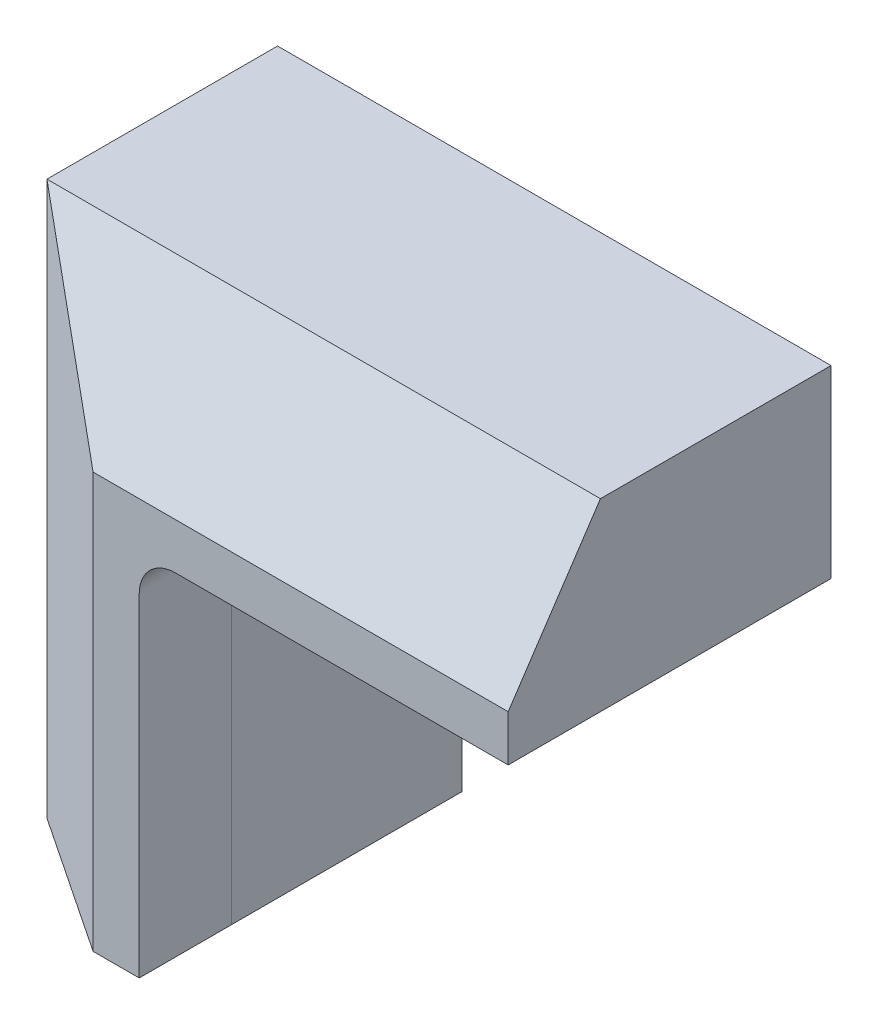
from build123d import *

# Parameters (mm, degrees)
BOSS_EXTRUDE1_DEPTH = 12.7
CUT_EXTRUDE1_DEPTH  = 2.54


with BuildPart() as part:
    # Sketch1 → Boss-Extrude1 (new body)
    with BuildSketch(Plane.XY):
        with BuildLine():
            Line((0, -1.99898), (0, -20.32))
            Line((0, -20.32), (-10.16, -20.32))
            Line((-10.16, -20.32), (-10.16, 0))
            Line((-10.16, 0), (-10.16, 6.1595))
            Line((-10.16, 6.1595), (-10.16, 10.16))
            Line((-10.16, 10.16), (-6.1595, 10.16))
            Line((-6.1595, 10.16), (20.32, 10.16))
            Line((20.32, 10.16), (20.32, 0))
            Line((20.32, 0), (1.99898, 0))
            ThreePointArc((1.99898, 0), (0.585487687, -0.585487687), (0, -1.99898))
        make_face()
    extrude(amount=BOSS_EXTRUDE1_DEPTH)

    # Sketch4 → Cut-Extrude1 (cut)
    # profile 1 of 5: a face of its own
    with BuildSketch(Plane.XY):
        with BuildLine():
            Line((5.478910256, 5.715), (4.842892628, 5.715))
            add(Edge.make_bspline(
                [(4.842892628, 5.715), (4.801336061, 5.714813984), (4.721164733, 5.71445512), (4.605551082, 5.710103418), (4.498891829, 5.702304902), (4.401211477, 5.692667169), (4.312550191, 5.679155443), (4.23279694, 5.663665308), (4.161935174, 5.644793814), (4.09916582, 5.622393613), (4.042832353, 5.59598465), (3.989522723, 5.56785722), (3.940441735, 5.534288125), (3.893112123, 5.498895298), (3.850239803, 5.458297677), (3.809150141, 5.415197093), (3.771583399, 5.367884211), (3.737365504, 5.316931741), (3.706324601, 5.263281068), (3.679205192, 5.206836279), (3.657207445, 5.147508057), (3.638754072, 5.085680187), (3.623932142, 5.021355365), (3.614066194, 4.954137987), (3.607364746, 4.88449739), (3.606773435, 4.837099955), (3.606474359, 4.813127003)],
                knots=[0, 0, 0, 0, 1.698747864, 3.27724071, 4.728299578, 6.070144658, 7.288476769, 8.393259625, 9.389771311, 10.283485332, 11.113357557, 11.931608583, 12.74405601, 13.541433047, 14.344816069, 15.154114104, 15.974336324, 16.810834471, 17.661136416, 18.50621059, 19.367396281, 20.244825668, 21.142564693, 22.063065223, 23.020325768, 24, 24, 24, 24], degree=3))
            add(Edge.make_bspline(
                [(3.606474359, 4.813127003), (3.606907085, 4.786606297), (3.607757445, 4.73448985), (3.616093713, 4.658093533), (3.630334691, 4.585256561), (3.648946906, 4.515364688), (3.674900315, 4.449567789), (3.704550867, 4.386295931), (3.74103045, 4.327323062), (3.782714206, 4.271911502), (3.828237623, 4.21961073), (3.878681424, 4.171930831), (3.93308413, 4.128546773), (3.991130823, 4.089003888), (4.053039427, 4.053381942), (4.118765272, 4.021347374), (4.188757172, 3.993924749), (4.237497425, 3.979582938), (4.262208534, 3.972311699)],
                knots=[0, 0, 0, 0, 1.102006807, 2.165578795, 3.188629044, 4.184801286, 5.166646146, 6.124351954, 7.085497154, 8.042432466, 9.003981491, 9.963833307, 10.922997304, 11.89326795, 12.880200226, 13.889073926, 14.929769137, 16, 16, 16, 16], degree=3))
            add(Edge.make_bspline(
                [(4.262208534, 3.972311699), (4.278484691, 3.968262164), (4.31374409, 3.959489569), (4.37208871, 3.950583183), (4.439324758, 3.942394308), (4.515669654, 3.935356962), (4.60116741, 3.930573206), (4.695735244, 3.926837306), (4.799416012, 3.924120921), (4.871511518, 3.924024531), (4.909038462, 3.923974359)],
                knots=[0, 0, 0, 0, 0.618981996, 1.340914327, 2.176866532, 3.120127938, 4.170906482, 5.338178032, 6.614476169, 8, 8, 8, 8], degree=3))
            Line((4.909038462, 3.923974359), (4.909038462, 2.54))
            Line((4.909038462, 2.54), (5.478910256, 2.54))
            Line((5.478910256, 2.54), (5.478910256, 5.715))
        make_face()
        with BuildLine():
            Line((4.909038462, 4.493846154), (4.707420873, 4.493846154))
            add(Edge.make_bspline(
                [(4.707420873, 4.493846154), (4.67073337, 4.494078781), (4.603227819, 4.494506819), (4.511039075, 4.500696491), (4.436954427, 4.510149371), (4.378426179, 4.523706987), (4.332212584, 4.544282464), (4.292356251, 4.568084417), (4.258170457, 4.598181333), (4.228570591, 4.632572209), (4.20490639, 4.672089049), (4.1884965, 4.716088399), (4.177836957, 4.763645784), (4.176852449, 4.796742577), (4.176346154, 4.813763021)],
                knots=[0, 0, 0, 0, 1.8619151, 3.425951444, 4.686033666, 5.651700536, 6.461346321, 7.243864085, 7.999046032, 8.762387399, 9.539336099, 10.322741239, 11.137448474, 12, 12, 12, 12], degree=3))
            add(Edge.make_bspline(
                [(4.176346154, 4.813763021), (4.176847241, 4.828633561), (4.177819472, 4.857485985), (4.184961741, 4.899127188), (4.196344465, 4.93794538), (4.212837593, 4.973535156), (4.234159303, 5.005836043), (4.260154781, 5.034835316), (4.290490456, 5.06115402), (4.313911371, 5.075084912), (4.325810296, 5.08216246)],
                knots=[0, 0, 0, 0, 1.102301479, 2.1387299, 3.123554645, 4.094223062, 5.036071848, 5.982632524, 6.975082478, 8, 8, 8, 8], degree=3))
            add(Edge.make_bspline(
                [(4.325810296, 5.08216246), (4.335889373, 5.087259738), (4.357228845, 5.098051721), (4.393572033, 5.11059819), (4.435511518, 5.121182518), (4.483330437, 5.129967409), (4.536838028, 5.136785396), (4.596024744, 5.141999451), (4.660977683, 5.144096225), (4.706148566, 5.144774724), (4.72968149, 5.145128205)],
                knots=[0, 0, 0, 0, 0.656809284, 1.390599849, 2.23162475, 3.173112763, 4.218524733, 5.370385145, 6.63003504, 8, 8, 8, 8], degree=3))
            Line((4.72968149, 5.145128205), (4.909038462, 5.145128205))
            Line((4.909038462, 5.145128205), (4.909038462, 4.493846154))
        make_face(mode=Mode.SUBTRACT)
    # profile 2 of 5: a face of its own
    with BuildSketch(Plane.XY):
        with BuildLine():
            Line((8.043333333, 5.715), (7.379330929, 5.715))
            add(Edge.make_bspline(
                [(7.379330929, 5.715), (7.335440573, 5.714844214), (7.251027053, 5.714544595), (7.129307369, 5.709817392), (7.0174911, 5.703239101), (6.915412692, 5.693200455), (6.823115815, 5.679890424), (6.740507968, 5.664200099), (6.667591563, 5.64631761), (6.603751653, 5.624034619), (6.546139291, 5.598899742), (6.49243656, 5.570019307), (6.441458697, 5.537714908), (6.393546436, 5.501136528), (6.348283406, 5.460942202), (6.305584217, 5.417091473), (6.266052248, 5.369212502), (6.229932282, 5.317607826), (6.197011841, 5.26332089), (6.167917075, 5.206277157), (6.144257163, 5.146436959), (6.123351095, 5.084665114), (6.108293131, 5.020078583), (6.097820538, 4.953306125), (6.090152914, 4.884112696), (6.089712063, 4.837105753), (6.089487179, 4.813127003)],
                knots=[0, 0, 0, 0, 1.749336639, 3.364467119, 4.854658419, 6.213483162, 7.451590619, 8.570285859, 9.5643256, 10.440900261, 11.26203566, 12.067320669, 12.869050712, 13.665104639, 14.467235401, 15.27997916, 16.102287765, 16.939272006, 17.78853747, 18.631303466, 19.488103222, 20.351255419, 21.228522269, 22.127379805, 23.044756219, 24, 24, 24, 24], degree=3))
            add(Edge.make_bspline(
                [(6.089487179, 4.813127003), (6.090071345, 4.788098697), (6.091216788, 4.739022751), (6.097386764, 4.666934188), (6.108663542, 4.597964894), (6.125743863, 4.532316801), (6.145375474, 4.469172843), (6.17148048, 4.409698066), (6.20094256, 4.353027495), (6.235933812, 4.299962756), (6.274335001, 4.249325176), (6.318994776, 4.203054868), (6.36701987, 4.158664978), (6.421109948, 4.118935939), (6.478880669, 4.081181417), (6.541479876, 4.046965765), (6.608499026, 4.015428881), (6.655616808, 3.997841737), (6.679711538, 3.988848157)],
                knots=[0, 0, 0, 0, 1.099860209, 2.156625411, 3.176576793, 4.16617041, 5.135385252, 6.078461593, 7.016046972, 7.938469504, 8.868247731, 9.803980173, 10.76021508, 11.73834243, 12.748633912, 13.790971185, 14.870363756, 16, 16, 16, 16], degree=3))
            Line((6.679711538, 3.988848157), (5.947019231, 2.54))
            Line((5.947019231, 2.54), (6.580492788, 2.54))
            Line((6.580492788, 2.54), (7.280112179, 3.923974359))
            Line((7.280112179, 3.923974359), (7.473461538, 3.923974359))
            Line((7.473461538, 3.923974359), (7.473461538, 2.54))
            Line((7.473461538, 2.54), (8.043333333, 2.54))
            Line((8.043333333, 2.54), (8.043333333, 5.715))
        make_face()
        with BuildLine():
            Line((7.473461538, 4.493846154), (7.251491386, 4.493846154))
            add(Edge.make_bspline(
                [(7.251491386, 4.493846154), (7.22435369, 4.494151797), (7.172390833, 4.494737037), (7.097661419, 4.497451626), (7.02978929, 4.503992443), (6.968482979, 4.512256521), (6.913433998, 4.521798593), (6.865133365, 4.53547296), (6.822836841, 4.550125392), (6.787045641, 4.568334563), (6.756466462, 4.58904234), (6.730063299, 4.612566889), (6.708224097, 4.63979356), (6.69024932, 4.669982448), (6.676266897, 4.703400567), (6.6660608, 4.739681062), (6.660357101, 4.779237214), (6.659700871, 4.806536345), (6.659358974, 4.820759215)],
                knots=[0, 0, 0, 0, 1.688639943, 3.233382647, 4.650958383, 5.928841754, 7.082724185, 8.122798841, 9.049171256, 9.863274652, 10.613301712, 11.341792392, 12.054588806, 12.776240173, 13.521029143, 14.301969904, 15.115324896, 16, 16, 16, 16], degree=3))
            add(Edge.make_bspline(
                [(6.659358974, 4.820759215), (6.660005361, 4.837585908), (6.661275067, 4.87063883), (6.673874499, 4.918223447), (6.693930073, 4.962266266), (6.721420772, 5.00256829), (6.756041733, 5.037899827), (6.795772017, 5.069044858), (6.8414691, 5.093672018), (6.88378116, 5.10991583), (6.922275245, 5.119634671), (6.957014942, 5.126877065), (6.99724372, 5.132009958), (7.04299195, 5.137454304), (7.094143018, 5.140984687), (7.150975728, 5.143561163), (7.213326856, 5.144615326), (7.256791515, 5.144952323), (7.279476162, 5.145128205)],
                knots=[0, 0, 0, 0, 1.020303359, 2.004196876, 2.966617323, 3.9489082, 4.950758222, 5.960522915, 7.003732012, 8.091992268, 8.70421221, 9.413913587, 10.24622431, 11.166358409, 12.212345909, 13.359657661, 14.621978493, 16, 16, 16, 16], degree=3))
            Line((7.279476162, 5.145128205), (7.473461538, 5.145128205))
            Line((7.473461538, 5.145128205), (7.473461538, 4.493846154))
        make_face(mode=Mode.SUBTRACT)
    # profile 3 of 5: a face of its own
    with BuildSketch(Plane.XY):
        Polygon((10.322184495, 5.715), (9.793653846, 5.715), (8.511442308, 2.54), (9.120111178, 2.54), (9.366886018, 3.191282051), (10.750224359, 3.191282051), (10.996999199, 2.54), (11.605032051, 2.54), align=None)
        Polygon((10.058237179, 4.863372396), (10.533978365, 3.761153846), (9.582495994, 3.761153846), align=None, mode=Mode.SUBTRACT)
    # profile 4 of 5: a face of its own
    with BuildSketch(Plane.XY):
        Polygon((14.271217949, 5.715), (13.701346154, 5.715), (13.701346154, 4.493846154), (12.602307692, 4.493846154), (12.602307692, 5.715), (12.032435897, 5.715), (12.032435897, 2.54), (12.602307692, 2.54), (12.602307692, 3.923974359), (13.701346154, 3.923974359), (13.701346154, 2.54), (14.271217949, 2.54), align=None)
    # profile 5 of 5: a face of its own
    with BuildSketch(Plane.XY):
        with BuildLine():
            Line((14.9225, 5.290776242), (15.348631811, 4.900897436))
            add(Edge.make_bspline(
                [(15.348631811, 4.900897436), (15.36688547, 4.92664612), (15.401929951, 4.976080004), (15.458733399, 5.042273139), (15.515280351, 5.098740809), (15.572094679, 5.145247119), (15.629679964, 5.181509507), (15.687936246, 5.207183679), (15.746533254, 5.223504993), (15.785901399, 5.22553739), (15.805292468, 5.226538462)],
                knots=[0, 0, 0, 0, 1.299362458, 2.494594718, 3.587462134, 4.587049575, 5.512617175, 6.380583204, 7.202344345, 8, 8, 8, 8], degree=3))
            add(Edge.make_bspline(
                [(15.805292468, 5.226538462), (15.823379901, 5.225904137), (15.858301982, 5.224679422), (15.908086, 5.212505847), (15.952284959, 5.191496044), (15.990855725, 5.16402396), (16.021409462, 5.130926467), (16.045804252, 5.096215707), (16.059540568, 5.057902879), (16.061348538, 5.031588082), (16.06224359, 5.018560697)],
                knots=[0, 0, 0, 0, 1.185010067, 2.2879431, 3.333075148, 4.379039566, 5.372662701, 6.27520591, 7.14612461, 8, 8, 8, 8], degree=3))
            add(Edge.make_bspline(
                [(16.06224359, 5.018560697), (16.061682706, 5.005345451), (16.060553164, 4.978731783), (16.049643325, 4.939726137), (16.033199083, 4.90161308), (16.017485938, 4.878411849), (16.009454127, 4.866552484)],
                knots=[0, 0, 0, 0, 0.967525499, 1.948461899, 2.951351359, 4, 4, 4, 4], degree=3))
            add(Edge.make_bspline(
                [(16.009454127, 4.866552484), (16.002152341, 4.857334324), (15.985344594, 4.836115336), (15.953295664, 4.802507766), (15.913048939, 4.761335552), (15.86305564, 4.714014485), (15.805391126, 4.658842714), (15.737382573, 4.597989063), (15.660987563, 4.529568965), (15.60668776, 4.481923686), (15.578234175, 4.456957131)],
                knots=[0, 0, 0, 0, 0.473873513, 1.090794244, 1.870441696, 2.795289791, 3.865433203, 5.087734844, 6.473946851, 8, 8, 8, 8], degree=3))
            add(Edge.make_bspline(
                [(15.578234175, 4.456957131), (15.551526392, 4.433842892), (15.500840568, 4.389976869), (15.428724707, 4.327716092), (15.365346876, 4.271701589), (15.309783804, 4.222774018), (15.262877774, 4.180420016), (15.224431593, 4.144437133), (15.193975705, 4.115525888), (15.176663316, 4.098063478), (15.16927484, 4.090610978)],
                knots=[0, 0, 0, 0, 1.543621617, 2.929473131, 4.163658386, 5.240097082, 6.164993805, 6.925417477, 7.541396219, 8, 8, 8, 8], degree=3))
            add(Edge.make_bspline(
                [(15.16927484, 4.090610978), (15.141244502, 4.060276149), (15.08736035, 4.001961956), (15.017329948, 3.911593297), (14.959692661, 3.823375058), (14.915103363, 3.735647272), (14.881427732, 3.6471442), (14.857685966, 3.55569531), (14.843466865, 3.460345018), (14.841888212, 3.395280084), (14.841089744, 3.362370793)],
                knots=[0, 0, 0, 0, 1.206664779, 2.319633467, 3.337109185, 4.282041471, 5.190008762, 6.099243693, 7.03861361, 8, 8, 8, 8], degree=3))
            add(Edge.make_bspline(
                [(14.841089744, 3.362370793), (14.841658073, 3.330304725), (14.842773157, 3.267389906), (14.856430799, 3.17532344), (14.875905794, 3.087211837), (14.906017552, 3.004013874), (14.942717586, 2.924363884), (14.988726378, 2.849502559), (15.042757396, 2.778672272), (15.104685238, 2.713139201), (15.173184785, 2.653672482), (15.24665706, 2.600733804), (15.32582051, 2.557026182), (15.409998777, 2.521036073), (15.499146801, 2.49331601), (15.593158381, 2.4728283), (15.692177312, 2.460531899), (15.759887885, 2.459246456), (15.794480168, 2.458589744)],
                knots=[0, 0, 0, 0, 1.043214005, 2.046824704, 3.02475056, 3.976699089, 4.921714032, 5.875962561, 6.831408892, 7.817874052, 8.806269674, 9.781291748, 10.760897367, 11.74438705, 12.757449933, 13.795994037, 14.874007457, 16, 16, 16, 16], degree=3))
            add(Edge.make_bspline(
                [(15.794480168, 2.458589744), (15.821634816, 2.459071485), (15.875416593, 2.46002561), (15.954682801, 2.467815242), (16.031223285, 2.480386881), (16.104951829, 2.498405794), (16.176200594, 2.521238201), (16.244972505, 2.549127112), (16.310792808, 2.582504794), (16.37415953, 2.620684869), (16.43476463, 2.665016965), (16.493374436, 2.714594728), (16.549406779, 2.770180684), (16.603130773, 2.831643377), (16.654202675, 2.899156853), (16.704294253, 2.971780861), (16.751179285, 3.050863206), (16.780142255, 3.106340111), (16.794935897, 3.134676482)],
                knots=[0, 0, 0, 0, 1.016823716, 2.013894106, 2.979844003, 3.91962641, 4.853723003, 5.779685073, 6.695824784, 7.614987388, 8.547259901, 9.504950863, 10.487499108, 11.500346958, 12.559593716, 13.656357062, 14.802919212, 16, 16, 16, 16], degree=3))
            Line((16.794935897, 3.134676482), (16.293754006, 3.435512821))
            add(Edge.make_bspline(
                [(16.293754006, 3.435512821), (16.275249371, 3.403347337), (16.239774404, 3.341683355), (16.179658755, 3.25882998), (16.118073341, 3.187879779), (16.053594364, 3.130086802), (15.987005863, 3.084678281), (15.9179862, 3.052226202), (15.846486884, 3.032138402), (15.797784798, 3.029685218), (15.773491587, 3.028461538)],
                knots=[0, 0, 0, 0, 1.283663364, 2.460892379, 3.537111102, 4.529833553, 5.449777664, 6.316464042, 7.160231139, 8, 8, 8, 8], degree=3))
            add(Edge.make_bspline(
                [(15.773491587, 3.028461538), (15.748781912, 3.029460861), (15.700841546, 3.031399693), (15.632412807, 3.049308096), (15.569674748, 3.077425604), (15.515444433, 3.117545409), (15.469525622, 3.163849762), (15.435634904, 3.215365473), (15.414344526, 3.271104227), (15.412093617, 3.309824033), (15.410961538, 3.329297877)],
                knots=[0, 0, 0, 0, 1.13588714, 2.203786484, 3.234766741, 4.283437687, 5.291419208, 6.222934724, 7.106237994, 8, 8, 8, 8], degree=3))
            add(Edge.make_bspline(
                [(15.410961538, 3.329297877), (15.412006966, 3.347415119), (15.414130653, 3.384218563), (15.429773076, 3.438939365), (15.454226954, 3.493635282), (15.483157617, 3.538498352), (15.512598188, 3.576060985), (15.540750015, 3.608607307), (15.575031493, 3.644565296), (15.615355699, 3.683980182), (15.661189846, 3.727198947), (15.712572543, 3.774217356), (15.770092176, 3.824621236), (15.810747165, 3.85895586), (15.832005208, 3.876909054)],
                knots=[0, 0, 0, 0, 0.916159276, 1.861089862, 2.860218735, 3.940849679, 4.552606315, 5.27541173, 6.11797699, 7.06649574, 8.129236253, 9.306560635, 10.591630461, 12, 12, 12, 12], degree=3))
            add(Edge.make_bspline(
                [(15.832005208, 3.876909054), (15.872417594, 3.911101808), (15.949981194, 3.976728051), (16.059588401, 4.073655946), (16.158354308, 4.164243946), (16.245425868, 4.249611915), (16.321912506, 4.328183306), (16.387296223, 4.400596305), (16.440858747, 4.46740948), (16.497221754, 4.546545214), (16.550777879, 4.642977544), (16.59706557, 4.758996816), (16.62709507, 4.875001367), (16.630459458, 4.952880433), (16.632115385, 4.991211939)],
                knots=[0, 0, 0, 0, 1.345494975, 2.582412109, 3.71882943, 4.751509156, 5.681369928, 6.505683931, 7.230279997, 7.856715994, 8.973648664, 10.023341002, 11.027102913, 12, 12, 12, 12], degree=3))
            add(Edge.make_bspline(
                [(16.632115385, 4.991211939), (16.631426687, 5.018394586), (16.630069878, 5.07194732), (16.617966935, 5.150688812), (16.599878625, 5.226667736), (16.573609206, 5.299606886), (16.539514672, 5.369414903), (16.498108184, 5.436433526), (16.44874678, 5.500045931), (16.393119809, 5.560209948), (16.331833129, 5.615193012), (16.266340524, 5.663721076), (16.197012686, 5.704708584), (16.124273729, 5.738710699), (16.047672919, 5.764737157), (15.967774572, 5.783186008), (15.884464087, 5.794158796), (15.827798094, 5.79565042), (15.798932292, 5.796410256)],
                knots=[0, 0, 0, 0, 1.010766082, 1.991317756, 2.957454644, 3.913069143, 4.869106762, 5.843196583, 6.838735724, 7.860187025, 8.887984031, 9.89767229, 10.887916223, 11.879572884, 12.879850636, 13.892031539, 14.926195476, 16, 16, 16, 16], degree=3))
            add(Edge.make_bspline(
                [(15.798932292, 5.796410256), (15.761523641, 5.795041768), (15.68700163, 5.792315594), (15.576818689, 5.770997805), (15.469196598, 5.737473336), (15.3824727, 5.697029753), (15.313468113, 5.657852034), (15.260582543, 5.621782126), (15.206768629, 5.580462108), (15.151592395, 5.533761769), (15.096079102, 5.480801214), (15.038650239, 5.42284121), (14.980088347, 5.359380848), (14.942032402, 5.314045059), (14.9225, 5.290776242)],
                knots=[0, 0, 0, 0, 1.282922637, 2.555718331, 3.837320111, 5.142675274, 5.830281639, 6.55870424, 7.337177975, 8.157850921, 9.037902056, 9.96903443, 10.957596896, 12, 12, 12, 12], degree=3))
        make_face()
    extrude(amount=CUT_EXTRUDE1_DEPTH, mode=Mode.SUBTRACT)

    # Sketch5 for Loft1 → Loft1 section 0
    with BuildSketch(Plane.XY.offset(12.7)):
        with BuildLine():
            Line((1.99898, 0), (20.32, 0))
            Line((20.32, 0), (20.32, 10.16))
            Line((20.32, 10.16), (-10.16, 10.16))
            Line((-10.16, 10.16), (-10.16, -20.32))
            Line((-10.16, -20.32), (0, -20.32))
            Line((0, -20.32), (0, -1.99898))
            # circular arc as an exact rational Bezier (weights 1, cos(half-angle), 1)
            Bezier((0, -1.99898), (0, 0), (1.99898, 0), weights=[1, 0.707106781, 1])
        make_face()
    # Sketch6 for Loft1 → Loft1 section 1
    with BuildSketch(Plane.XY.offset(17.78)):
        with BuildLine():
            Line((0, -1.99898), (0, -20.32))
            Line((0, -20.32), (-2.54, -20.32))
            Line((-2.54, -20.32), (-2.54, 2.54))
            Line((-2.54, 2.54), (20.32, 2.54))
            Line((20.32, 2.54), (20.32, 0))
            Line((20.32, 0), (1.99898, 0))
            Bezier((1.99898, 0), (0, 0), (0, -1.99898), weights=[1, 0.707106781, 1])
        make_face()
    loft()


solid = part.part
